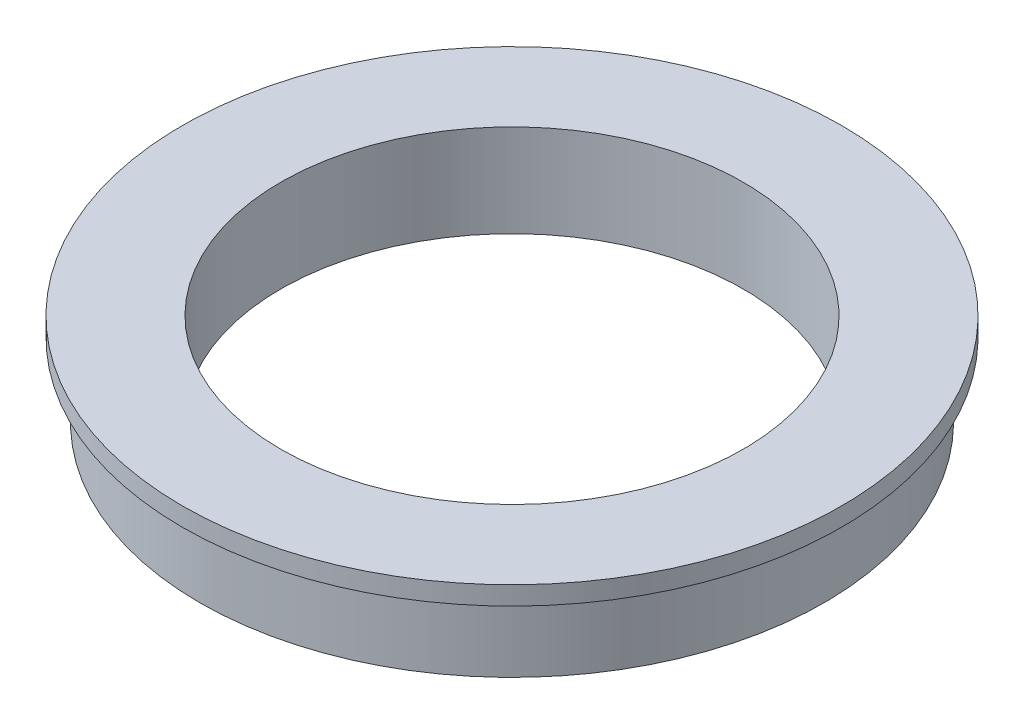
from build123d import *

# Parameters (mm, degrees)
SKETCH_1_R      = 13.5
SKETCH_1_R_2    = 10
EXTRUDE_1_DEPTH = 3.2
SKETCH_2_R      = 14.25
SKETCH_2_R_2    = 10
EXTRUDE_2_DEPTH = 0.8


with BuildPart() as part:
    # 草图1 → 凸台-拉伸1 (new body)
    with BuildSketch(Plane(origin=(0, 0, 0), x_dir=(1, 0, 0), z_dir=(0, 1, 0))):
        with Locations(Location((0, 0, 0), (0, 0, 270))):
            Circle(SKETCH_1_R)
        with Locations(Location((0, 0, 0), (0, 0, 270))):
            Circle(SKETCH_1_R_2, mode=Mode.SUBTRACT)
    extrude(amount=EXTRUDE_1_DEPTH)

    # 草图2 → 凸台-拉伸2 (add)
    with BuildSketch(Plane(origin=(0, 3.2, 0), x_dir=(1, 0, 0), z_dir=(0, 1, 0))):
        with Locations(Location((0, 0, 0), (0, 0, 270))):
            Circle(SKETCH_2_R)
        with Locations(Location((0, 0, 0), (0, 0, 270))):
            Circle(SKETCH_2_R_2, mode=Mode.SUBTRACT)
    extrude(amount=EXTRUDE_2_DEPTH)


solid = part.part
